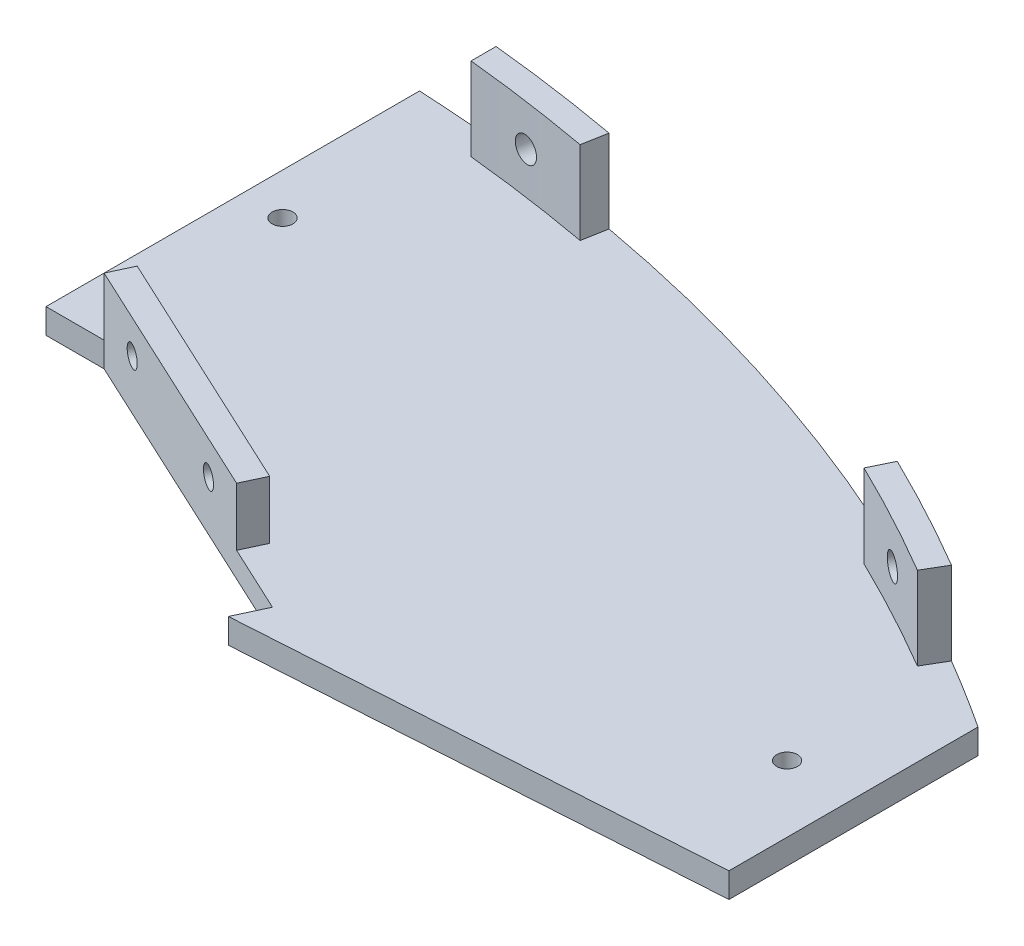
from build123d import *

# Parameters (mm, degrees)
BOSS_EXTRUDE1_DEPTH     = 3
SKETCH2_W               = 33
SKETCH2_H               = 10
SKETCH2_R               = 1.25
BOSS_EXTRUDE2_DEPTH     = 3
SKETCH3_R               = 1.25
CUT_EXTRUDE1_DEPTH      = 111.114926801
BOSS_EXTRUDE3_DEPTH     = 10
CUT_EXTRUDE2_REACH      = 107.286
CUT_EXTRUDE2_END_RADIUS = 197.003812576
SKETCH8_R               = 1.5
CUT_EXTRUDE3_REACH      = 97.662
CUT_EXTRUDE3_END_RADIUS = 197.003812576
SKETCH9_R               = 1.5


with BuildPart() as part:
    # Sketch1 → Boss-Extrude1 (new body)
    with BuildSketch(Plane(origin=(0, 0, 0), x_dir=(1, 0, 0), z_dir=(0, 1, 0))):
        with BuildLine():
            Line((0, 45), (0, 0))
            Line((0, 0), (7, 0))
            Line((7, 0), (45.00148551, -17.720383715))
            Line((45.00148551, -17.720383715), (43.311012463, -21.345614863))
            Line((43.311012463, -21.345614863), (100.00148551, -17.720383715))
            Line((100.00148551, -17.720383715), (100.00148551, 12.279616285))
            ThreePointArc((100.00148551, 12.279616285), (52.191052923, 35.333931061), (0, 45))
        make_face()
    extrude(amount=BOSS_EXTRUDE1_DEPTH)

    # Sketch2 → Boss-Extrude2 (add)
    with BuildSketch(Plane(origin=(1.250243366, 0, -2.681155551), x_dir=(0.9063077870366495, 0, 0.42261826174070033), z_dir=(-0.42261826174070033, 0, 0.9063077870366495))):
        with Locations((22.844154509, 5)):
            Rectangle(SKETCH2_W, SKETCH2_H)
        with Locations((13.344154509, 6)):
            Circle(SKETCH2_R, mode=Mode.SUBTRACT)
        with Locations((32.344154509, 6)):
            Circle(SKETCH2_R, mode=Mode.SUBTRACT)
    extrude(amount=-BOSS_EXTRUDE2_DEPTH)

    # Sketch3 → Cut-Extrude1 (cut, through all)
    with BuildSketch(Plane.XZ):
        with Locations(Location((5, -23.5, 0), (0, 0, 270))):
            Circle(SKETCH3_R)
        with Locations(Location((92.00148551, 2.720383715, 0), (0, 0, 270))):
            Circle(SKETCH3_R)
    extrude(amount=-CUT_EXTRUDE1_DEPTH, mode=Mode.SUBTRACT)

    # Sketch6 → Boss-Extrude3 (add)
    with BuildSketch(Plane(origin=(0, 3, 0), x_dir=(1, 0, 0), z_dir=(0, 1, 0))):
        with BuildLine():
            ThreePointArc((25.815183319, 42.016667614), (17.915864182, 43.291962745), (9.971855225, 44.250264466))
            Line((9.971855225, 44.250264466), (9.971855225, 41.238788581))
            ThreePointArc((9.971855225, 41.238788581), (17.646509134, 40.304062324), (25.278576941, 39.068923955))
            Line((25.278576941, 39.068923955), (25.815183319, 42.016667614))
        make_face()
        with BuildLine():
            ThreePointArc((91.515126037, 17.56938971), (84.541117021, 21.492248202), (77.415775106, 25.13300679))
            Line((77.415775106, 25.13300679), (76.106143507, 22.438196193))
            ThreePointArc((76.106143507, 22.438196193), (83.124741123, 18.85197958), (89.994272948, 14.987889185))
            Line((89.994272948, 14.987889185), (91.515126037, 17.56938971))
        make_face()
    extrude(amount=BOSS_EXTRUDE3_DEPTH)

    # Cut-Extrude2: up to this cylinder (the profile starts outside it)
    cut_extrude2_end = Plane(origin=(-10.004096478, 8, 154.749638432), z_dir=(0, -1, 0)) * Cylinder(CUT_EXTRUDE2_END_RADIUS, 609.579625152, mode=Mode.PRIVATE)
    # Sketch8 → Cut-Extrude2 (cut, up to the surface)
    with BuildSketch(Plane(origin=(17.915864182, 13, -43.291962745), x_dir=(-0.9902080058846244, 0, -0.13959980330213892), z_dir=(0.13959980330213892, 0, -0.9902080058846244)), mode=Mode.PRIVATE) as cut_extrude2_sk1:
        with Locations((0, -5)):
            Circle(SKETCH8_R)
    cut_extrude2_tool1 = extrude(cut_extrude2_sk1.sketch, amount=-CUT_EXTRUDE2_REACH, mode=Mode.PRIVATE) - cut_extrude2_end
    add(cut_extrude2_tool1.solids().sort_by_distance((17.915864, 8, -43.291963))[0], mode=Mode.SUBTRACT)

    # Cut-Extrude3: up to this cylinder (the profile starts outside it)
    cut_extrude3_end = Plane(origin=(-10.004096478, 8, 154.749638432), z_dir=(0, -1, 0)) * Cylinder(CUT_EXTRUDE3_END_RADIUS, 590.331625152, mode=Mode.PRIVATE)
    # Sketch9 → Cut-Extrude3 (cut, up to the surface)
    with BuildSketch(Plane(origin=(84.541117021, 13, -21.492248202), x_dir=(-0.8812094331704029, 0, -0.4727260674973377), z_dir=(0.4727260674973377, 0, -0.8812094331704029)), mode=Mode.PRIVATE) as cut_extrude3_sk1:
        with Locations((0, -5)):
            Circle(SKETCH9_R)
    cut_extrude3_tool1 = extrude(cut_extrude3_sk1.sketch, amount=-CUT_EXTRUDE3_REACH, mode=Mode.PRIVATE) - cut_extrude3_end
    add(cut_extrude3_tool1.solids().sort_by_distance((84.541117, 8, -21.492248))[0], mode=Mode.SUBTRACT)


solid = part.part
